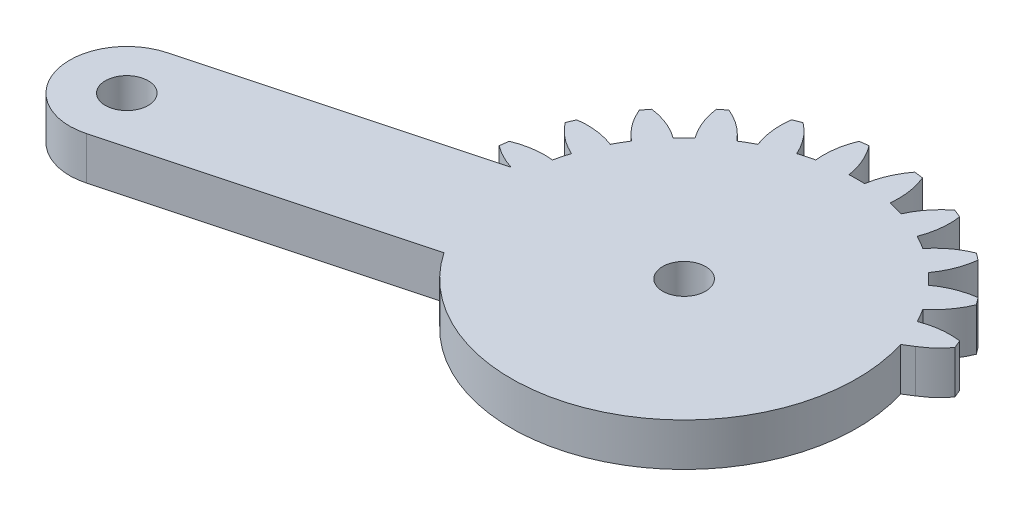
from build123d import *
from build123d.topology import SkipClean

# Parameters (mm, degrees)
SKETCH1_R           = 1.5
BOSS_EXTRUDE1_DEPTH = 3
SKETCH3_R           = 1.5
BOSS_EXTRUDE2_DEPTH = 3
CUT_EXTRUDE1_START  = -3
CUT_EXTRUDE1_DEPTH  = 3


with BuildPart() as part:
    # Sketch1 → Boss-Extrude1 (new body)
    with BuildSketch(Plane(origin=(0, 0, 0), x_dir=(1, 0, 0), z_dir=(0, 1, 0))):
        with BuildLine():
            Line((20.643657446, 4), (2.081641936, 4))
            ThreePointArc((2.081641936, 4), (2.861028333, 4.588201733), (3.521749436, 5.30713988))
            ThreePointArc((3.521749436, 5.30713988), (3.405395609, 5.596745198), (3.282888305, 5.883801663))
            ThreePointArc((3.282888305, 5.883801663), (1.93527598, 5.894040025), (0.627094961, 5.57027124))
            ThreePointArc((0.627094961, 5.57027124), (0.366286148, 6.046375), (0.084372603, 6.510293938))
            ThreePointArc((0.084372603, 6.510293938), (1.018855105, 7.48132754), (1.683794586, 8.65351323))
            ThreePointArc((1.683794586, 8.65351323), (1.496450048, 8.903135899), (1.303821399, 9.148703928))
            ThreePointArc((1.303821399, 9.148703928), (-0.000522033, 8.809805691), (-1.180330337, 8.158486898))
            ThreePointArc((-1.180330337, 8.158486898), (-1.555477026, 8.550865528), (-1.947855656, 8.926012217))
            ThreePointArc((-1.947855656, 8.926012217), (-1.296536862, 10.105820521), (-0.957638625, 11.410163953))
            ThreePointArc((-0.957638625, 11.410163953), (-1.203206655, 11.602792602), (-1.452829324, 11.79013714))
            ThreePointArc((-1.452829324, 11.79013714), (-2.625015014, 11.125197659), (-3.596048616, 10.190715157))
            ThreePointArc((-3.596048616, 10.190715157), (-4.059967554, 10.472628702), (-4.536071314, 10.733437515))
            ThreePointArc((-4.536071314, 10.733437515), (-4.212302529, 12.041618533), (-4.222540891, 13.389230859))
            ThreePointArc((-4.222540891, 13.389230859), (-4.509597355, 13.511738163), (-4.799202674, 13.62809199))
            ThreePointArc((-4.799202674, 13.62809199), (-5.759348103, 12.682425791), (-6.455432668, 11.528463019))
            ThreePointArc((-6.455432668, 11.528463019), (-6.976508546, 11.680699536), (-7.503891752, 11.809396783))
            ThreePointArc((-7.503891752, 11.809396783), (-7.529737283, 13.156800143), (-7.888414517, 14.455843809))
            ThreePointArc((-7.888414517, 14.455843809), (-8.197396993, 14.499881098), (-8.507248835, 14.537314892))
            ThreePointArc((-8.507248835, 14.537314892), (-9.18992168, 13.375367565), (-9.563620196, 12.080565177))
            ThreePointArc((-9.563620196, 12.080565177), (-10.106342554, 12.09275), (-10.649064912, 12.080565177))
            ThreePointArc((-10.649064912, 12.080565177), (-11.022763428, 13.375367565), (-11.705436272, 14.537314892))
            ThreePointArc((-11.705436272, 14.537314892), (-12.015288115, 14.499881098), (-12.324270591, 14.455843809))
            ThreePointArc((-12.324270591, 14.455843809), (-12.682947825, 13.156800143), (-12.708793355, 11.809396783))
            ThreePointArc((-12.708793355, 11.809396783), (-13.236176561, 11.680699536), (-13.757252439, 11.528463019))
            ThreePointArc((-13.757252439, 11.528463019), (-14.453337005, 12.682425791), (-15.413482434, 13.62809199))
            ThreePointArc((-15.413482434, 13.62809199), (-15.703087752, 13.511738163), (-15.990144217, 13.389230859))
            ThreePointArc((-15.990144217, 13.389230859), (-16.000382579, 12.041618533), (-15.676613793, 10.733437515))
            ThreePointArc((-15.676613793, 10.733437515), (-16.152717554, 10.472628702), (-16.616636492, 10.190715157))
            ThreePointArc((-16.616636492, 10.190715157), (-17.587670094, 11.125197659), (-18.759855783, 11.79013714))
            ThreePointArc((-18.759855783, 11.79013714), (-19.009478453, 11.602792602), (-19.255046482, 11.410163953))
            ThreePointArc((-19.255046482, 11.410163953), (-18.916148245, 10.105820521), (-18.264829452, 8.926012217))
            ThreePointArc((-18.264829452, 8.926012217), (-18.657208082, 8.550865528), (-19.032354771, 8.158486898))
            ThreePointArc((-19.032354771, 8.158486898), (-20.212163074, 8.809805691), (-21.516506507, 9.148703928))
            ThreePointArc((-21.516506507, 9.148703928), (-21.709135156, 8.903135899), (-21.896479694, 8.65351323))
            ThreePointArc((-21.896479694, 8.65351323), (-21.231540213, 7.48132754), (-20.297057711, 6.510293938))
            ThreePointArc((-20.297057711, 6.510293938), (-20.578971255, 6.046375), (-20.839780068, 5.57027124))
            ThreePointArc((-20.839780068, 5.57027124), (-22.147961087, 5.894040025), (-23.495573413, 5.883801663))
            ThreePointArc((-23.495573413, 5.883801663), (-23.618080717, 5.596745198), (-23.734434544, 5.30713988))
            ThreePointArc((-23.734434544, 5.30713988), (-22.788768345, 4.346994451), (-21.634805572, 3.650909885))
            ThreePointArc((-21.634805572, 3.650909885), (-21.78704209, 3.129834008), (-21.915739337, 2.602450802))
            ThreePointArc((-21.915739337, 2.602450802), (-23.263142697, 2.576605271), (-24.562186363, 2.217928037))
            ThreePointArc((-24.562186363, 2.217928037), (-24.606223651, 1.908945561), (-24.643657446, 1.599093719))
            ThreePointArc((-24.643657446, 1.599093719), (-23.481710119, 0.916420874), (-22.186907731, 0.542722358))
            ThreePointArc((-22.186907731, 0.542722358), (-22.199092554, 0), (-22.186907731, -0.542722358))
            ThreePointArc((-22.186907731, -0.542722358), (-23.481710119, -0.916420874), (-24.643657446, -1.599093719))
            ThreePointArc((-24.643657446, -1.599093719), (-24.606223651, -1.908945561), (-24.562186363, -2.217928037))
            ThreePointArc((-24.562186363, -2.217928037), (-23.263142697, -2.576605271), (-21.915739337, -2.602450802))
            ThreePointArc((-21.915739337, -2.602450802), (-21.78704209, -3.129834008), (-21.634805572, -3.650909885))
            ThreePointArc((-21.634805572, -3.650909885), (-22.788768345, -4.346994451), (-23.734434544, -5.30713988))
            ThreePointArc((-23.734434544, -5.30713988), (-23.618080717, -5.596745198), (-23.495573413, -5.883801663))
            ThreePointArc((-23.495573413, -5.883801663), (-22.147961087, -5.894040025), (-20.839780068, -5.57027124))
            ThreePointArc((-20.839780068, -5.57027124), (-20.578971255, -6.046375), (-20.297057711, -6.510293938))
            ThreePointArc((-20.297057711, -6.510293938), (-21.231540213, -7.48132754), (-21.896479694, -8.65351323))
            ThreePointArc((-21.896479694, -8.65351323), (-21.709135156, -8.903135899), (-21.516506507, -9.148703928))
            ThreePointArc((-21.516506507, -9.148703928), (-20.212163074, -8.809805691), (-19.032354771, -8.158486898))
            ThreePointArc((-19.032354771, -8.158486898), (-18.657208082, -8.550865528), (-18.264829452, -8.926012217))
            ThreePointArc((-18.264829452, -8.926012217), (-18.916148245, -10.105820521), (-19.255046482, -11.410163953))
            ThreePointArc((-19.255046482, -11.410163953), (-19.009478453, -11.602792602), (-18.759855783, -11.79013714))
            ThreePointArc((-18.759855783, -11.79013714), (-17.587670094, -11.125197659), (-16.616636492, -10.190715157))
            ThreePointArc((-16.616636492, -10.190715157), (-16.152717554, -10.472628702), (-15.676613793, -10.733437515))
            ThreePointArc((-15.676613793, -10.733437515), (-16.000382579, -12.041618533), (-15.990144217, -13.389230859))
            ThreePointArc((-15.990144217, -13.389230859), (-15.703087752, -13.511738163), (-15.413482434, -13.62809199))
            ThreePointArc((-15.413482434, -13.62809199), (-14.453337005, -12.682425791), (-13.757252439, -11.528463019))
            ThreePointArc((-13.757252439, -11.528463019), (-13.236176561, -11.680699536), (-12.708793355, -11.809396783))
            ThreePointArc((-12.708793355, -11.809396783), (-12.682947825, -13.156800143), (-12.324270591, -14.455843809))
            ThreePointArc((-12.324270591, -14.455843809), (-12.015288115, -14.499881098), (-11.705436272, -14.537314892))
            ThreePointArc((-11.705436272, -14.537314892), (-11.022763428, -13.375367565), (-10.649064912, -12.080565177))
            ThreePointArc((-10.649064912, -12.080565177), (-10.106342554, -12.09275), (-9.563620196, -12.080565177))
            ThreePointArc((-9.563620196, -12.080565177), (-9.18992168, -13.375367565), (-8.507248835, -14.537314892))
            ThreePointArc((-8.507248835, -14.537314892), (-8.197396993, -14.499881098), (-7.888414517, -14.455843809))
            ThreePointArc((-7.888414517, -14.455843809), (-7.529737283, -13.156800143), (-7.503891752, -11.809396783))
            ThreePointArc((-7.503891752, -11.809396783), (-6.976508546, -11.680699536), (-6.455432668, -11.528463019))
            ThreePointArc((-6.455432668, -11.528463019), (-5.759348103, -12.682425791), (-4.799202674, -13.62809199))
            ThreePointArc((-4.799202674, -13.62809199), (-4.509597355, -13.511738163), (-4.222540891, -13.389230859))
            ThreePointArc((-4.222540891, -13.389230859), (-4.212302529, -12.041618533), (-4.536071314, -10.733437515))
            ThreePointArc((-4.536071314, -10.733437515), (-4.059967554, -10.472628702), (-3.596048616, -10.190715157))
            ThreePointArc((-3.596048616, -10.190715157), (-2.625015014, -11.125197659), (-1.452829324, -11.79013714))
            ThreePointArc((-1.452829324, -11.79013714), (-1.203206655, -11.602792602), (-0.957638625, -11.410163953))
            ThreePointArc((-0.957638625, -11.410163953), (-1.296536862, -10.105820521), (-1.947855656, -8.926012217))
            ThreePointArc((-1.947855656, -8.926012217), (-1.555477026, -8.550865528), (-1.180330337, -8.158486898))
            ThreePointArc((-1.180330337, -8.158486898), (-0.000522033, -8.809805691), (1.303821399, -9.148703928))
            ThreePointArc((1.303821399, -9.148703928), (1.496450048, -8.903135899), (1.683794586, -8.65351323))
            ThreePointArc((1.683794586, -8.65351323), (1.018855105, -7.48132754), (0.084372603, -6.510293938))
            ThreePointArc((0.084372603, -6.510293938), (0.366286148, -6.046375), (0.627094961, -5.57027124))
            ThreePointArc((0.627094961, -5.57027124), (1.93527598, -5.894040025), (3.282888305, -5.883801663))
            ThreePointArc((3.282888305, -5.883801663), (3.405395609, -5.596745198), (3.521749436, -5.30713988))
            ThreePointArc((3.521749436, -5.30713988), (2.861028333, -4.588201733), (2.081641936, -4))
            Line((2.081641936, -4), (20.643657446, -4))
            ThreePointArc((20.643657446, -4), (24.643657446, 0), (20.643657446, 4))
        make_face()
        with Locations(Location((-10.106342554, 0, 0), (0, 0, 270))):
            Circle(SKETCH1_R, mode=Mode.SUBTRACT)
        with Locations(Location((20.643657446, 0, 0), (0, 0, 270))):
            Circle(SKETCH1_R, mode=Mode.SUBTRACT)
    extrude(amount=BOSS_EXTRUDE1_DEPTH)

    # Sketch3 → Boss-Extrude2 (add)
    with BuildSketch(Plane(origin=(0, 3, 0), x_dir=(1, 0, 0), z_dir=(0, 1, 0))):
        with BuildLine():
            ThreePointArc((-9.071066373, -3.863703305), (-13.970045859, -1.03527618), (-11.141618734, 3.863703305))
            Line((-11.141618734, 3.863703305), (-41.891618734, -4.375734362))
            ThreePointArc((-41.891618734, -4.375734362), (-44.720045859, -9.274713848), (-39.821066373, -12.103140972))
            Line((-39.821066373, -12.103140972), (-9.071066373, -3.863703305))
        make_face()
        with Locations(Location((-40.856342554, -8.239437667, 0), (0, 0, 270))):
            Circle(SKETCH3_R, mode=Mode.SUBTRACT)
    extrude(amount=-BOSS_EXTRUDE2_DEPTH)

    # Sketch4 → Cut-Extrude1 (cut)
    with SkipClean():  # the faces are left unmerged after this step: merging them gives an invalid solid
        with BuildSketch(Plane(origin=(0, 3, 0), x_dir=(1, 0, 0), z_dir=(0, 1, 0)).offset(CUT_EXTRUDE1_START)):
            with BuildLine():
                ThreePointArc((-21.516506507, -9.148703928), (-20.212163074, -8.809805691), (-19.032354771, -8.158486898))
                ThreePointArc((-19.032354771, -8.158486898), (-19.58704562, -7.506721784), (-20.094248238, -6.817355984))
                Line((-20.094248238, -6.817355984), (-20.843755363, -7.018185813))
                ThreePointArc((-20.843755363, -7.018185813), (-21.444347002, -7.788065101), (-21.896479694, -8.65351323))
                ThreePointArc((-21.896479694, -8.65351323), (-21.709135156, -8.903135899), (-21.516506507, -9.148703928))
            make_face()
            with BuildLine():
                ThreePointArc((-18.759855783, -11.79013714), (-17.587670094, -11.125197659), (-16.616636492, -10.190715157))
                ThreePointArc((-16.616636492, -10.190715157), (-17.467942324, -9.593823606), (-18.264829452, -8.926012217))
                ThreePointArc((-18.264829452, -8.926012217), (-18.916148245, -10.105820521), (-19.255046482, -11.410163953))
                ThreePointArc((-19.255046482, -11.410163953), (-19.009478453, -11.602792602), (-18.759855783, -11.79013714))
            make_face()
            with BuildLine():
                ThreePointArc((-15.413482434, -13.62809199), (-14.453337005, -12.682425791), (-13.757252439, -11.528463019))
                ThreePointArc((-13.757252439, -11.528463019), (-14.734037631, -11.172244217), (-15.676613793, -10.733437515))
                ThreePointArc((-15.676613793, -10.733437515), (-16.000382579, -12.041618533), (-15.990144217, -13.389230859))
                ThreePointArc((-15.990144217, -13.389230859), (-15.703087752, -13.511738163), (-15.413482434, -13.62809199))
            make_face()
            with BuildLine():
                ThreePointArc((-11.705436272, -14.537314892), (-11.022763428, -13.375367565), (-10.649064912, -12.080565177))
                ThreePointArc((-10.649064912, -12.080565177), (-11.684763165, -11.989294847), (-12.708793355, -11.809396783))
                ThreePointArc((-12.708793355, -11.809396783), (-12.682947825, -13.156800143), (-12.324270591, -14.455843809))
                ThreePointArc((-12.324270591, -14.455843809), (-12.015288115, -14.499881098), (-11.705436272, -14.537314892))
            make_face()
            with BuildLine():
                ThreePointArc((-7.888414517, -14.455843809), (-7.529737283, -13.156800143), (-7.503891752, -11.809396783))
                ThreePointArc((-7.503891752, -11.809396783), (-8.527921943, -11.989294847), (-9.563620196, -12.080565177))
                ThreePointArc((-9.563620196, -12.080565177), (-9.18992168, -13.375367565), (-8.507248835, -14.537314892))
                ThreePointArc((-8.507248835, -14.537314892), (-8.197396993, -14.499881098), (-7.888414517, -14.455843809))
            make_face()
            with BuildLine():
                ThreePointArc((-4.222540891, -13.389230859), (-4.212302529, -12.041618533), (-4.536071314, -10.733437515))
                ThreePointArc((-4.536071314, -10.733437515), (-5.478647477, -11.172244217), (-6.455432668, -11.528463019))
                ThreePointArc((-6.455432668, -11.528463019), (-5.759348103, -12.682425791), (-4.799202674, -13.62809199))
                ThreePointArc((-4.799202674, -13.62809199), (-4.509597355, -13.511738163), (-4.222540891, -13.389230859))
            make_face()
            with BuildLine():
                ThreePointArc((-0.957638625, -11.410163953), (-1.296536862, -10.105820521), (-1.947855656, -8.926012217))
                ThreePointArc((-1.947855656, -8.926012217), (-2.744742783, -9.593823606), (-3.596048616, -10.190715157))
                ThreePointArc((-3.596048616, -10.190715157), (-2.625015014, -11.125197659), (-1.452829324, -11.79013714))
                ThreePointArc((-1.452829324, -11.79013714), (-1.203206655, -11.602792602), (-0.957638625, -11.410163953))
            make_face()
            with BuildLine():
                ThreePointArc((1.683794586, -8.65351323), (1.018855105, -7.48132754), (0.084372603, -6.510293938))
                ThreePointArc((0.084372603, -6.510293938), (-0.512518948, -7.361599771), (-1.180330337, -8.158486898))
                ThreePointArc((-1.180330337, -8.158486898), (-0.000522033, -8.809805691), (1.303821399, -9.148703928))
                ThreePointArc((1.303821399, -9.148703928), (1.496450048, -8.903135899), (1.683794586, -8.65351323))
            make_face()
            with BuildLine():
                ThreePointArc((20.643657446, -4), (24.643657446, 0), (20.643657446, 4))
                Line((20.643657446, 4), (2.081641936, 4))
                Line((2.081641936, 4), (1.43808022, 3.600125745))
                ThreePointArc((1.43808022, 3.600125745), (1.848539735, 1.820821801), (1.986407446, 0))
                ThreePointArc((1.986407446, 0), (1.641665343, -2.866864669), (0.627094961, -5.57027124))
                ThreePointArc((0.627094961, -5.57027124), (1.93527598, -5.894040025), (3.282888305, -5.883801663))
                ThreePointArc((3.282888305, -5.883801663), (3.405395609, -5.596745198), (3.521749436, -5.30713988))
                ThreePointArc((3.521749436, -5.30713988), (2.861028333, -4.588201733), (2.081641936, -4))
                Line((2.081641936, -4), (20.643657446, -4))
            make_face()
        extrude(amount=CUT_EXTRUDE1_DEPTH, mode=Mode.SUBTRACT)


solid = part.part
